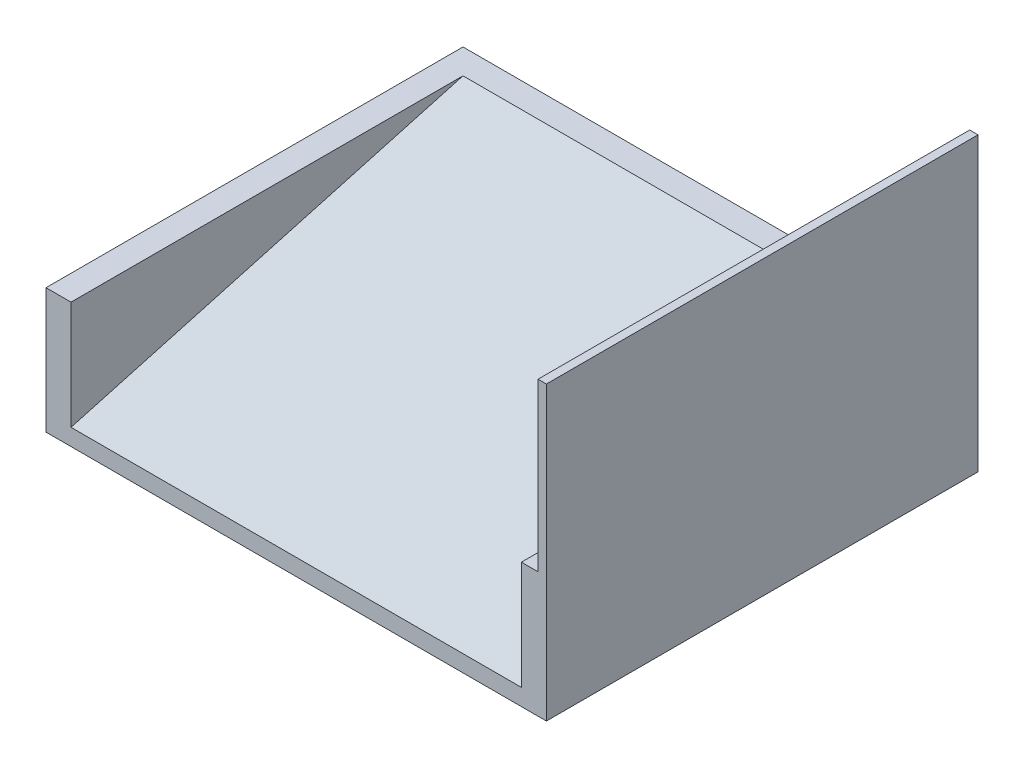
from build123d import *

# Parameters (mm, degrees)
SKETCH1_W           = 60
SKETCH1_H           = 50
BOSS_EXTRUDE1_DEPTH = 2
BOSS_EXTRUDE2_DEPTH = 13
SKETCH3_W           = 9
SKETCH3_H           = 15
BOSS_EXTRUDE3_DEPTH = 1.75
FILLET1_R           = 1.5
CUT_EXTRUDE1_REACH  = 81.53
SKETCH4_R           = 2.005
SKETCH5_W           = 1
SKETCH5_H           = 51.75
BOSS_EXTRUDE4_DEPTH = 20
SKETCH6_W           = 54
SKETCH6_H           = 2
CUT_EXTRUDE2_DEPTH  = 47
BOSS_EXTRUDE5_REACH = 86.57


with BuildPart() as part:
    # Sketch1 → Boss-Extrude1 (new body)
    with BuildSketch(Plane(origin=(0, 0, 0), x_dir=(1, 0, 0), z_dir=(0, 1, 0))):
        with Locations((30, 25)):
            Rectangle(SKETCH1_W, SKETCH1_H)
    extrude(amount=BOSS_EXTRUDE1_DEPTH)

    # Sketch2 → Boss-Extrude2 (add)
    with BuildSketch(Plane(origin=(0, 2, 0), x_dir=(1, 0, 0), z_dir=(0, 1, 0))):
        Polygon((60, 0), (60, 50), (0, 50), (0, 0), (3, 0), (3, 47), (57, 47), (57, 0), align=None)
    extrude(amount=BOSS_EXTRUDE2_DEPTH)

    # Sketch3 → Boss-Extrude3 (add)
    with BuildSketch(Plane(origin=(0, 0, -50), x_dir=(-1, 0, 0), z_dir=(0, 0, -1))):
        with Locations((-55.5, 7.5)):
            Rectangle(SKETCH3_W, SKETCH3_H)
    extrude(amount=BOSS_EXTRUDE3_DEPTH)

    # Fillet1
    fillet1_edges = [part.edges().sort_by_distance(p)[0] for p in [
        (51, 7.5, -50),
    ]]
    fillet(fillet1_edges, radius=FILLET1_R)

    # Sketch4 → Cut-Extrude1 (cut, up to next)
    with BuildSketch(Plane(origin=(0, 0, -50), x_dir=(-1, 0, 0), z_dir=(0, 0, -1)), mode=Mode.PRIVATE) as cut_extrude1_sk1:
        with Locations((-45, 5.6)):
            Circle(SKETCH4_R)
    cut_extrude1_tool1 = extrude(cut_extrude1_sk1.sketch, amount=-CUT_EXTRUDE1_REACH, mode=Mode.PRIVATE) & part.part
    # Sketch4 → Cut-Extrude1 (cut, up to next)
    with BuildSketch(Plane(origin=(0, 0, -50), x_dir=(-1, 0, 0), z_dir=(0, 0, -1)), mode=Mode.PRIVATE) as cut_extrude1_sk2:
        with Locations((-35, 5.6)):
            Circle(SKETCH4_R)
    cut_extrude1_tool2 = extrude(cut_extrude1_sk2.sketch, amount=-CUT_EXTRUDE1_REACH, mode=Mode.PRIVATE) & part.part
    # Sketch4 → Cut-Extrude1 (cut, up to next)
    with BuildSketch(Plane(origin=(0, 0, -50), x_dir=(-1, 0, 0), z_dir=(0, 0, -1)), mode=Mode.PRIVATE) as cut_extrude1_sk3:
        with Locations((-25, 5.6)):
            Circle(SKETCH4_R)
    cut_extrude1_tool3 = extrude(cut_extrude1_sk3.sketch, amount=-CUT_EXTRUDE1_REACH, mode=Mode.PRIVATE) & part.part
    # Sketch4 → Cut-Extrude1 (cut, up to next)
    with BuildSketch(Plane(origin=(0, 0, -50), x_dir=(-1, 0, 0), z_dir=(0, 0, -1)), mode=Mode.PRIVATE) as cut_extrude1_sk4:
        with Locations((-15, 5.6)):
            Circle(SKETCH4_R)
    cut_extrude1_tool4 = extrude(cut_extrude1_sk4.sketch, amount=-CUT_EXTRUDE1_REACH, mode=Mode.PRIVATE) & part.part
    add(cut_extrude1_tool1.solids().sort_by_distance((45, 5.6, -50))[0], mode=Mode.SUBTRACT)
    add(cut_extrude1_tool2.solids().sort_by_distance((35, 5.6, -50))[0], mode=Mode.SUBTRACT)
    add(cut_extrude1_tool3.solids().sort_by_distance((25, 5.6, -50))[0], mode=Mode.SUBTRACT)
    add(cut_extrude1_tool4.solids().sort_by_distance((15, 5.6, -50))[0], mode=Mode.SUBTRACT)

    # Sketch5 → Boss-Extrude4 (add)
    with BuildSketch(Plane(origin=(0, 15, 0), x_dir=(1, 0, 0), z_dir=(0, 1, 0))):
        with Locations((59.5, 25.875)):
            Rectangle(SKETCH5_W, SKETCH5_H)
    extrude(amount=BOSS_EXTRUDE4_DEPTH)

    # Sketch6 → Cut-Extrude2 (cut)
    with BuildSketch(Plane.XY):
        with Locations((30, 1)):
            Rectangle(SKETCH6_W, SKETCH6_H)
    extrude(amount=-CUT_EXTRUDE2_DEPTH, mode=Mode.SUBTRACT)

    # Sketch7 → Boss-Extrude5 (add, up to next)
    with BuildSketch(Plane(origin=(3, 0, 0), x_dir=(0, 0, -1), z_dir=(1, 0, 0)), mode=Mode.PRIVATE) as boss_extrude5_sk1:
        Polygon((0, 2), (0, 0), (2, 0), (47, 13), (47, 15), align=None)
    boss_extrude5_tool1 = extrude(boss_extrude5_sk1.sketch, amount=BOSS_EXTRUDE5_REACH, mode=Mode.PRIVATE) - part.part
    add(boss_extrude5_tool1.solids().sort_by_distance((3, 7.115265, -22.629283))[0])


solid = part.part
